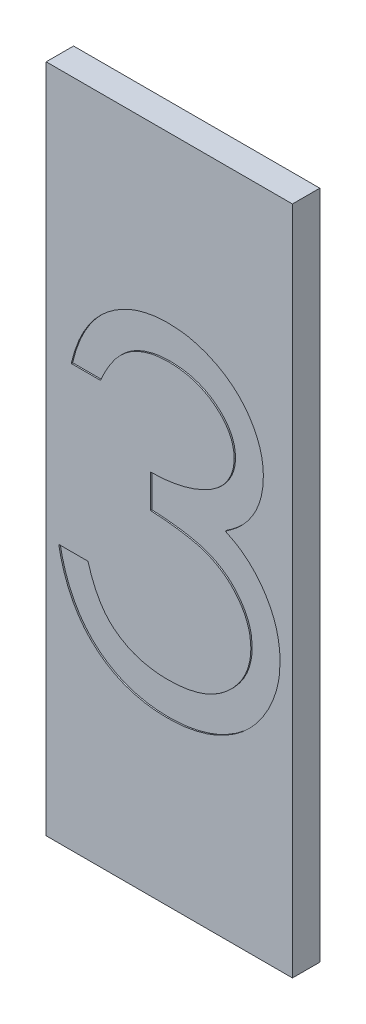
from build123d import *

# Parameters (mm, degrees)
SKETCH_1_W          = 18
SKETCH_1_H          = 49
EXTRUDE_1_DEPTH     = 2
CUT_EXTRUDE_1_DEPTH = 0.1


with BuildPart() as part:
    # ｽｹｯﾁ1 → ﾎﾞｽ - 押し出し1 (new body)
    with BuildSketch(Plane.XY):
        with Locations((9, 24.5)):
            Rectangle(SKETCH_1_W, SKETCH_1_H)
    extrude(amount=EXTRUDE_1_DEPTH)

    # ｽｹｯﾁ2 → ｶｯﾄ - 押し出し1 (cut)
    with BuildSketch(Plane.XY.offset(2)):
        with BuildLine():
            Line((3.96875, 30.817307692), (1.831730769, 30.817307692))
            add(Edge.make_bspline(
                [(1.831730769, 30.817307692), (1.889626105, 31.057014414), (2.002806751, 31.525621447), (2.238874171, 32.195142276), (2.496044103, 32.828714805), (2.804852118, 33.414475592), (3.141688464, 33.964196698), (3.527605552, 34.465409849), (3.944798664, 34.930862346), (4.406250551, 35.343929194), (4.890179482, 35.717974102), (5.403404305, 36.036891903), (5.93559935, 36.311240157), (6.490451915, 36.537256378), (7.069613904, 36.707519315), (7.667849377, 36.831050439), (8.286726048, 36.911272127), (8.706830191, 36.919101426), (8.920147236, 36.923076923)],
                knots=[0, 0, 0, 0, 1.162005537, 2.271625781, 3.343758855, 4.383309926, 5.390229558, 6.379919256, 7.361854164, 8.333198761, 9.295911338, 10.242430842, 11.177959212, 12.116337295, 13.062827104, 14.020064771, 14.994644689, 16, 16, 16, 16], degree=3))
            add(Edge.make_bspline(
                [(8.920147236, 36.923076923), (9.230953034, 36.913693232), (9.845785055, 36.895130534), (10.749047928, 36.725623386), (11.620087537, 36.457391682), (12.449369741, 36.086775788), (13.219659434, 35.629662104), (13.905025276, 35.085616305), (14.496177465, 34.465135343), (14.992119571, 33.779794147), (15.380433403, 33.047352199), (15.666771052, 32.293515415), (15.841089988, 31.520072003), (15.863681634, 30.997848371), (15.875, 30.736215445)],
                knots=[0, 0, 0, 0, 1.083050992, 2.142477498, 3.193116406, 4.255571735, 5.30263384, 6.308962982, 7.297363603, 8.282367274, 9.249857812, 10.179914175, 11.08814088, 12, 12, 12, 12], degree=3))
            add(Edge.make_bspline(
                [(15.875, 30.736215445), (15.867083425, 30.484437074), (15.851591917, 29.991745873), (15.72005367, 29.272462115), (15.498690882, 28.594543371), (15.192055533, 27.955135821), (14.795124628, 27.358293607), (14.314297887, 26.802673886), (13.746181563, 26.285812292), (13.315658788, 25.989724449), (13.094012921, 25.837289663)],
                knots=[0, 0, 0, 0, 1.024540389, 2.004866551, 2.965041327, 3.920577974, 4.882998113, 5.874504559, 6.905732034, 8, 8, 8, 8], degree=3))
            add(Edge.make_bspline(
                [(13.094012921, 25.837289663), (13.347321822, 25.714973889), (13.84920002, 25.472630963), (14.53330273, 24.997362327), (15.154318275, 24.448611107), (15.500645363, 24.020376272), (15.674654447, 23.805213341)],
                knots=[0, 0, 0, 0, 1.015518401, 2.012035669, 3.001164323, 4, 4, 4, 4], degree=3))
            add(Edge.make_bspline(
                [(15.674654447, 23.805213341), (15.789235723, 23.648338281), (16.016521926, 23.337157099), (16.297070826, 22.836846773), (16.551586407, 22.330991105), (16.749912006, 21.806031574), (16.903494922, 21.268052678), (17.01327757, 20.716130662), (17.081477528, 20.14981483), (17.091244409, 19.766688849), (17.096153846, 19.57410607)],
                knots=[0, 0, 0, 0, 1.025084078, 2.033381695, 3.024893161, 4.013698104, 4.991890475, 5.976764909, 6.982997093, 8, 8, 8, 8], degree=3))
            add(Edge.make_bspline(
                [(17.096153846, 19.57410607), (17.083944745, 19.240664931), (17.059584, 18.575351833), (16.841841994, 17.592407744), (16.504294767, 16.631569952), (16.024935971, 15.712578635), (15.440730241, 14.852740686), (14.745695589, 14.08341794), (13.947729132, 13.422120293), (13.057783557, 12.869600706), (12.09360095, 12.427926985), (11.062345583, 12.121375454), (9.978876466, 11.921717849), (9.235876817, 11.900307902), (8.858135517, 11.889423077)],
                knots=[0, 0, 0, 0, 0.955779014, 1.907060117, 2.875433937, 3.871313158, 4.872415639, 5.851225146, 6.836215519, 7.83643374, 8.849228613, 9.86973379, 10.916971861, 12, 12, 12, 12], degree=3))
            add(Edge.make_bspline(
                [(8.858135517, 11.889423077), (8.603550635, 11.895330028), (8.10261248, 11.906952938), (7.366170107, 11.986409135), (6.663213546, 12.131529349), (5.992792353, 12.326814337), (5.354310945, 12.574408154), (4.749717658, 12.882737153), (4.175292847, 13.245445765), (3.636457125, 13.666815354), (3.133274727, 14.138175897), (2.6791178, 14.667895233), (2.266414566, 15.246181142), (1.906215542, 15.879750506), (1.582114132, 16.56041556), (1.315543695, 17.296891951), (1.080918665, 18.082595744), (0.971833846, 18.630131797), (0.915865385, 18.911057692)],
                knots=[0, 0, 0, 0, 1.048658725, 2.063410685, 3.046034179, 4.001477787, 4.936774919, 5.862367409, 6.792675028, 7.730719943, 8.675894397, 9.627829632, 10.600096036, 11.597688215, 12.626045268, 13.701542398, 14.82072376, 16, 16, 16, 16], degree=3))
            Line((0.915865385, 18.911057692), (3.052884615, 18.911057692))
            add(Edge.make_bspline(
                [(3.052884615, 18.911057692), (3.108560223, 18.727708156), (3.216854116, 18.371077381), (3.401192108, 17.857813873), (3.611206602, 17.387292118), (3.836503867, 16.95606052), (4.073121509, 16.55987221), (4.337881982, 16.209203423), (4.61117563, 15.888651779), (4.817183373, 15.708053616), (4.91800631, 15.619666466)],
                knots=[0, 0, 0, 0, 1.198163088, 2.33053128, 3.407730985, 4.417276592, 5.372219308, 6.28897303, 7.162600585, 8, 8, 8, 8], degree=3))
            add(Edge.make_bspline(
                [(4.91800631, 15.619666466), (5.051333018, 15.516875838), (5.317574885, 15.311611871), (5.7514266, 15.049663291), (6.207707343, 14.822689173), (6.696303609, 14.649309029), (7.206671958, 14.502503872), (7.747061711, 14.406433912), (8.312705313, 14.340519746), (8.698928847, 14.334703158), (8.896296575, 14.331730769)],
                knots=[0, 0, 0, 0, 0.946170439, 1.889420265, 2.845303464, 3.807233317, 4.801018734, 5.828864929, 6.890507805, 8, 8, 8, 8], degree=3))
            add(Edge.make_bspline(
                [(8.896296575, 14.331730769), (9.119137369, 14.335921125), (9.554883306, 14.344115003), (10.190710117, 14.419469365), (10.795598287, 14.529213785), (11.362831943, 14.698711043), (11.899841288, 14.908130765), (12.399098582, 15.171077952), (12.867157805, 15.479584005), (13.298023938, 15.830234352), (13.685456766, 16.214102024), (14.026584526, 16.615601668), (14.316584455, 17.033040437), (14.550515585, 17.468728367), (14.735236293, 17.920861263), (14.860988069, 18.390707941), (14.94842427, 18.87442327), (14.95554497, 19.203232863), (14.959134615, 19.368990385)],
                knots=[0, 0, 0, 0, 1.217147791, 2.380027433, 3.494444702, 4.572153297, 5.609568379, 6.639424714, 7.649109417, 8.668170816, 9.669597737, 10.625200337, 11.543417969, 12.441394052, 13.322311151, 14.205496177, 15.095365482, 16, 16, 16, 16], degree=3))
            add(Edge.make_bspline(
                [(14.959134615, 19.368990385), (14.9487231, 19.590863958), (14.927951874, 20.033507093), (14.769370289, 20.684728446), (14.508529088, 21.31217702), (14.143364324, 21.905147663), (13.698848027, 22.454712279), (13.179293929, 22.945055758), (12.580387589, 23.349664771), (12.029163123, 23.629214379), (11.540903755, 23.819966623), (11.1230598, 23.947023077), (10.655269338, 24.054612413), (10.143189357, 24.154708404), (9.582961402, 24.23989829), (8.975195387, 24.310939929), (8.319768151, 24.367784047), (7.866030041, 24.393168821), (7.632211538, 24.40625)],
                knots=[0, 0, 0, 0, 1.07054697, 2.135767047, 3.216561865, 4.33974944, 5.486079747, 6.621378074, 7.775625952, 8.963672916, 9.598146892, 10.304877434, 11.070270905, 11.915000392, 12.823868403, 13.805723172, 14.86925407, 16, 16, 16, 16], degree=3))
            Line((7.632211538, 24.40625), (7.632211538, 26.848557692))
            add(Edge.make_bspline(
                [(7.632211538, 26.848557692), (7.926814112, 26.853556982), (8.503868184, 26.863349362), (9.346791937, 26.981786004), (10.152833578, 27.145620277), (10.904129805, 27.396571318), (11.588900515, 27.688038337), (12.182985665, 28.027211406), (12.678062149, 28.40422961), (13.071724082, 28.824912185), (13.367878298, 29.276091347), (13.584414188, 29.746331464), (13.712323551, 30.239754093), (13.729398249, 30.576494602), (13.737980769, 30.745755709)],
                knots=[0, 0, 0, 0, 1.321986639, 2.589447074, 3.816329219, 5.01088745, 6.139805852, 7.153945165, 8.075214402, 8.924034688, 9.728124013, 10.488707548, 11.240355623, 12, 12, 12, 12], degree=3))
            add(Edge.make_bspline(
                [(13.737980769, 30.745755709), (13.735161295, 30.870109654), (13.729552084, 31.117505929), (13.658813462, 31.478946128), (13.552514183, 31.829336493), (13.40637531, 32.167186952), (13.21077128, 32.490154351), (12.976687693, 32.800992173), (12.697958296, 33.097925741), (12.378561594, 33.374697201), (12.035581278, 33.638466475), (11.659685487, 33.862396755), (11.26220809, 34.053883695), (10.842709027, 34.211791201), (10.399826937, 34.330576715), (9.935642679, 34.415865208), (9.449271118, 34.469189251), (9.117449155, 34.47686651), (8.948768029, 34.480769231)],
                knots=[0, 0, 0, 0, 0.884392785, 1.759457502, 2.611959086, 3.489218968, 4.37281399, 5.2945488, 6.255912374, 7.266815255, 8.301784654, 9.332968512, 10.37626691, 11.440494194, 12.520033166, 13.637162961, 14.798855837, 16, 16, 16, 16], degree=3))
            add(Edge.make_bspline(
                [(8.948768029, 34.480769231), (8.677634359, 34.471303), (8.148047241, 34.45281325), (7.384585039, 34.290867747), (6.674840998, 34.032481144), (6.132333285, 33.724054708), (5.731721485, 33.419591935), (5.445448031, 33.153692127), (5.164320987, 32.858193809), (4.906835221, 32.514896649), (4.646435487, 32.14704938), (4.409368024, 31.735952547), (4.179001189, 31.292329793), (4.040190985, 30.97871485), (3.96875, 30.817307692)],
                knots=[0, 0, 0, 0, 1.472543308, 2.876219568, 4.221790263, 5.565193594, 6.249813518, 6.953379497, 7.687249741, 8.463570142, 9.283606569, 10.136032583, 11.040678096, 12, 12, 12, 12], degree=3))
        make_face()
    extrude(amount=-CUT_EXTRUDE_1_DEPTH, mode=Mode.SUBTRACT)


solid = part.part
